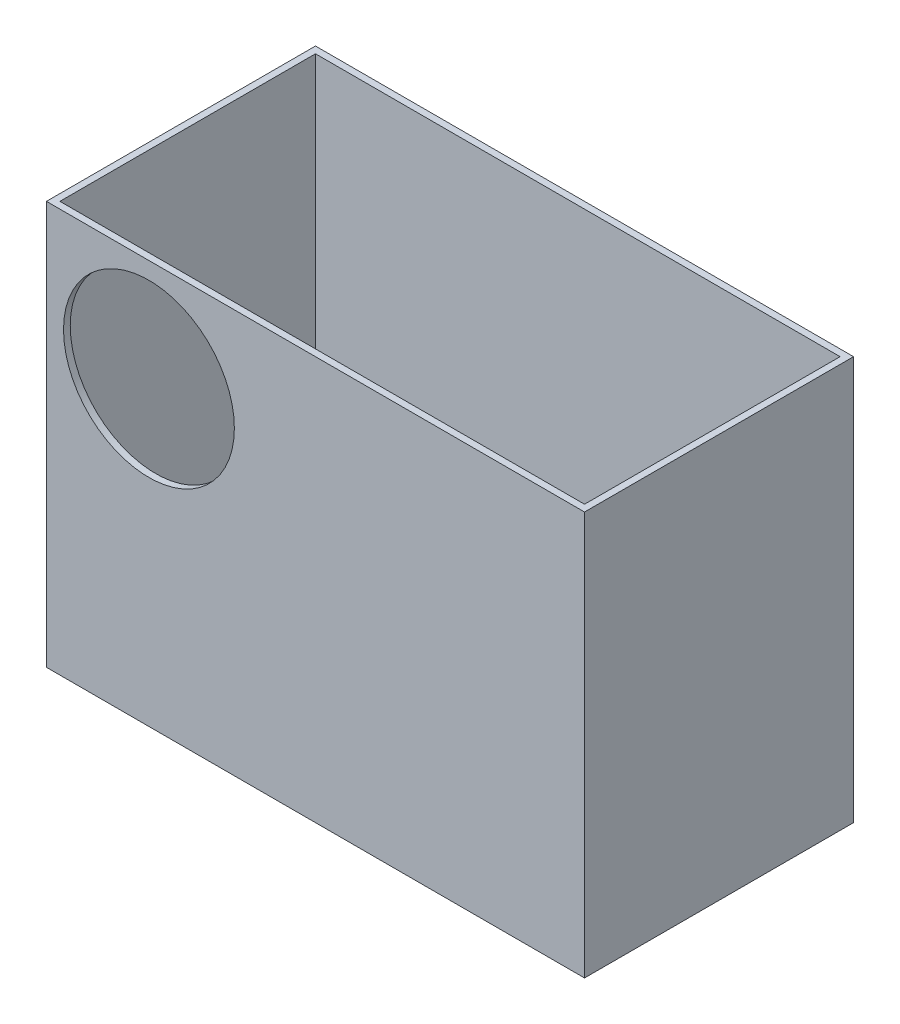
from build123d import *

# Parameters (mm, degrees)
SKETCH1_W           = 400
SKETCH1_H           = 200
SKETCH1_W_2         = 390
SKETCH1_H_2         = 190
BOSS_EXTRUDE1_DEPTH = 300
CUT_EXTRUDE1_REACH  = 414.311
SKETCH7_R           = 63.5
SKETCH8_W           = 400
SKETCH8_H           = 200
BOSS_EXTRUDE2_DEPTH = 0.5


with BuildPart() as part:
    # Sketch1 → Boss-Extrude1 (new body)
    with BuildSketch(Plane(origin=(0, 0, 0), x_dir=(1, 0, 0), z_dir=(0, 1, 0))):
        Rectangle(SKETCH1_W, SKETCH1_H)
        Rectangle(SKETCH1_W_2, SKETCH1_H_2, mode=Mode.SUBTRACT)
    extrude(amount=BOSS_EXTRUDE1_DEPTH)

    # Sketch7 → Cut-Extrude1 (cut, up to next)
    with BuildSketch(Plane.XY.offset(100), mode=Mode.PRIVATE) as cut_extrude1_sk1:
        with Locations((-123.8, 223.8)):
            Circle(SKETCH7_R)
    cut_extrude1_tool1 = extrude(cut_extrude1_sk1.sketch, amount=-CUT_EXTRUDE1_REACH, mode=Mode.PRIVATE) & part.part
    add(cut_extrude1_tool1.solids().sort_by_distance((-123.8, 223.8, 100))[0], mode=Mode.SUBTRACT)

    # Sketch8 → Boss-Extrude2 (add)
    with BuildSketch(Plane.XZ):
        Rectangle(SKETCH8_W, SKETCH8_H)
    extrude(amount=-BOSS_EXTRUDE2_DEPTH)


solid = part.part
